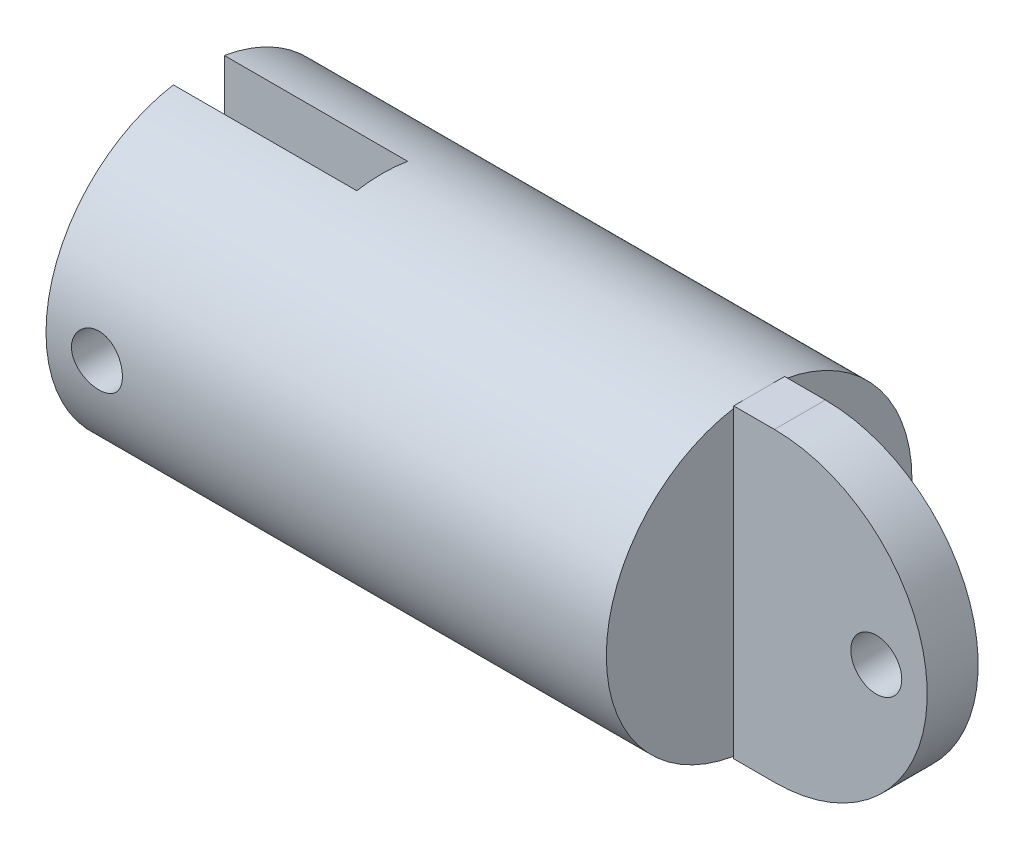
from build123d import *

# Parameters (mm, degrees)
SKETCH2_R               = 15
BOSS_EXTRUDE1_DEPTH     = 55
CUT_EXTRUDE1_DEPTH      = 59.949130613
CUT_EXTRUDE1_DEPTH_BACK = 59.949130613
SKETCH3_W               = 18
SKETCH3_H               = 5
CUT_EXTRUDE2_DEPTH      = 59.949130613
CUT_EXTRUDE2_DEPTH_BACK = 59.949130613
SKETCH6_R               = 2.5
SKETCH7_W               = 5
SKETCH7_H               = 30
BOSS_EXTRUDE2_DEPTH     = 4
BOSS_EXTRUDE3_DEPTH     = 5
CUT_EXTRUDE3_DEPTH      = 60.634302356
CUT_EXTRUDE3_DEPTH_BACK = 60.634302356
SKETCH9_R               = 2.5


with BuildPart() as part:
    # Sketch2 → Boss-Extrude1 (new body)
    with BuildSketch(Plane(origin=(0, 0, 0), x_dir=(0, 0, -1), z_dir=(1, 0, 0))):
        Circle(SKETCH2_R)
    extrude(amount=-BOSS_EXTRUDE1_DEPTH)

    # Sketch3 → Cut-Extrude1 (cut, two sides: drawn at the far end of the back side and taken through both)
    with BuildSketch(Plane(origin=(0, 0, 0), x_dir=(1, 0, 0), z_dir=(0, 1, 0)).offset(-CUT_EXTRUDE1_DEPTH_BACK)):
        with Locations((-46, 0)):
            Rectangle(SKETCH3_W, SKETCH3_H)
    extrude(amount=CUT_EXTRUDE1_DEPTH + CUT_EXTRUDE1_DEPTH_BACK, mode=Mode.SUBTRACT)

    # Sketch6 → Cut-Extrude2 (cut, two sides: drawn at the far end of the back side and taken through both)
    with BuildSketch(Plane.XY.offset(-CUT_EXTRUDE2_DEPTH_BACK)):
        with Locations((-50, 0)):
            Circle(SKETCH6_R)
    extrude(amount=CUT_EXTRUDE2_DEPTH + CUT_EXTRUDE2_DEPTH_BACK, mode=Mode.SUBTRACT)

    # Sketch7 → Boss-Extrude2 (add)
    with BuildSketch(Plane(origin=(0, 0, 0), x_dir=(0, 0, -1), z_dir=(1, 0, 0))):
        Rectangle(SKETCH7_W, SKETCH7_H)
    extrude(amount=BOSS_EXTRUDE2_DEPTH)

    # Sketch8 → Boss-Extrude3 (add)
    with BuildSketch(Plane.XY.offset(2.5)):
        with BuildLine():
            Line((4, 15), (4, -15))
            ThreePointArc((4, -15), (19, 0), (4, 15))
        make_face()
    extrude(amount=-BOSS_EXTRUDE3_DEPTH)

    # Sketch9 → Cut-Extrude3 (cut, two sides: drawn at the far end of the back side and taken through both)
    with BuildSketch(Plane.XY.offset(2.5).offset(-CUT_EXTRUDE3_DEPTH_BACK)):
        with Locations(Location((14, 0, 0), (0, 0, 270))):
            Circle(SKETCH9_R)
    extrude(amount=CUT_EXTRUDE3_DEPTH + CUT_EXTRUDE3_DEPTH_BACK, mode=Mode.SUBTRACT)


solid = part.part
